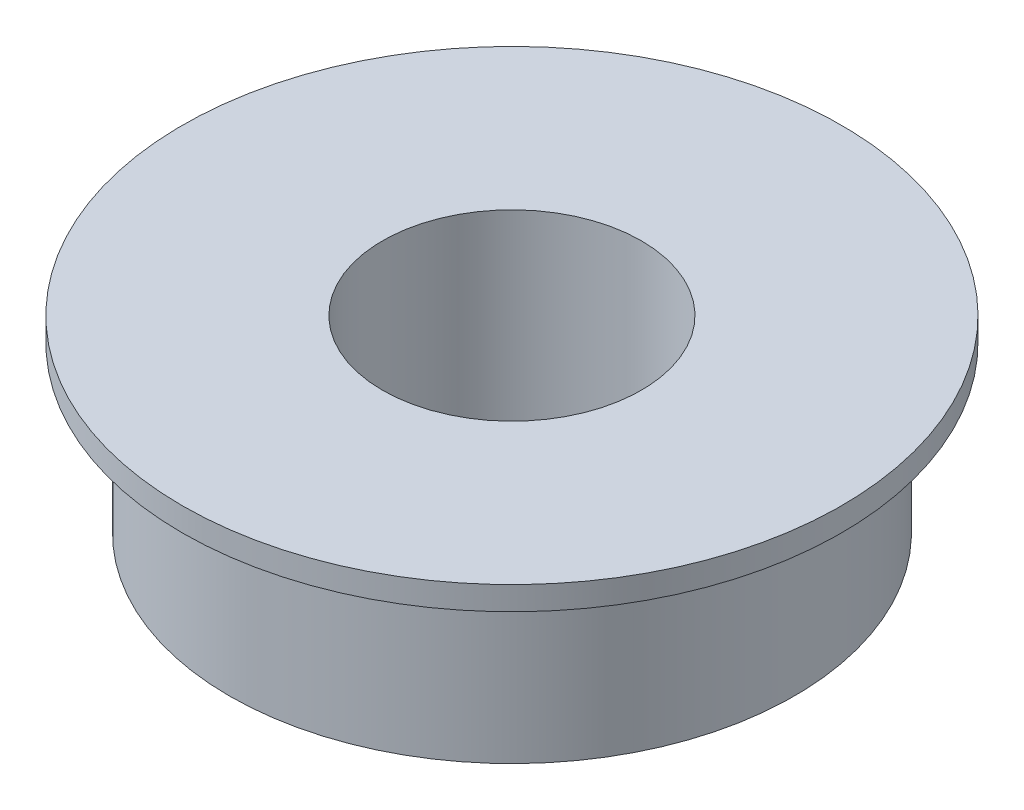
from build123d import *

# Parameters (mm, degrees)
SKETCH1_R           = 6
SKETCH1_R_2         = 2.75
BOSS_EXTRUDE1_DEPTH = 4
BOSS_EXTRUDE2_START = -0.5
SKETCH2_R           = 7
SKETCH2_R_2         = 2.75
BOSS_EXTRUDE2_DEPTH = 0.5


with BuildPart() as part:
    # Sketch1 → Boss-Extrude1 (new body)
    with BuildSketch(Plane(origin=(0, 0, 0), x_dir=(1, 0, 0), z_dir=(0, 1, 0))):
        with Locations(Location((0, 0, 0), (0, 0, 270))):
            Circle(SKETCH1_R)
        with Locations(Location((0, 0, 0), (0, 0, 270))):
            Circle(SKETCH1_R_2, mode=Mode.SUBTRACT)
    extrude(amount=BOSS_EXTRUDE1_DEPTH)

    # Sketch2 → Boss-Extrude2 (add)
    with BuildSketch(Plane(origin=(0, 4, 0), x_dir=(1, 0, 0), z_dir=(0, 1, 0)).offset(BOSS_EXTRUDE2_START)):
        with Locations(Location((0, 0, 0), (0, 0, 270))):
            Circle(SKETCH2_R)
        with Locations(Location((0, 0, 0), (0, 0, 270))):
            Circle(SKETCH2_R_2, mode=Mode.SUBTRACT)
    extrude(amount=BOSS_EXTRUDE2_DEPTH)


solid = part.part
